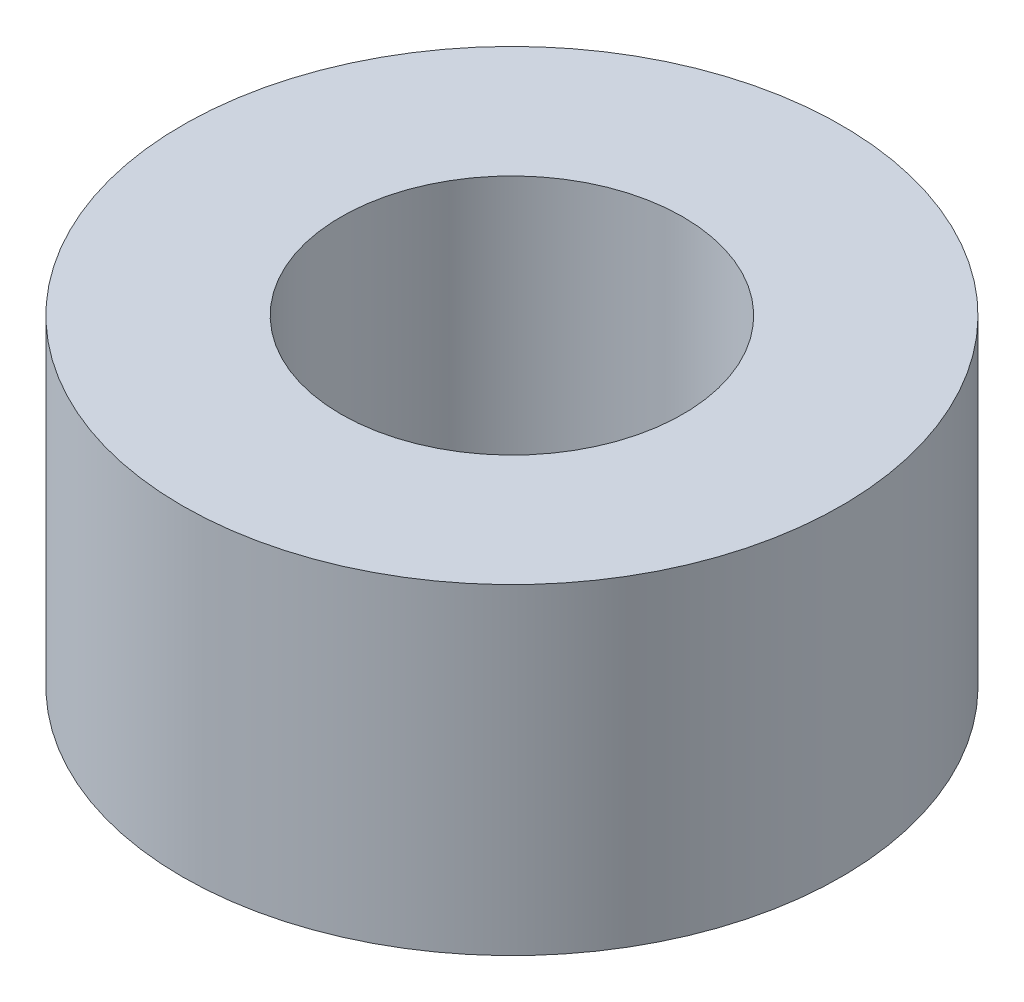
from build123d import *

# Parameters (mm, degrees)
SKIZZE2_R                       = 4
AUFSATZ_LINEAR_AUSTRAGEN1_DEPTH = 3.9
SKIZZE3_R                       = 2.075
SCHNITT_LINEAR_AUSTRAGEN1_DEPTH = 3.9


with BuildPart() as part:
    # Skizze2 → Aufsatz-Linear austragen1 (new body)
    with BuildSketch(Plane(origin=(0, 0, 0), x_dir=(1, 0, 0), z_dir=(0, 1, 0))):
        with Locations(Location((0, 0, 0), (0, 0, 270))):
            Circle(SKIZZE2_R)
    extrude(amount=AUFSATZ_LINEAR_AUSTRAGEN1_DEPTH)

    # Skizze3 → Schnitt-Linear austragen1 (cut)
    with BuildSketch(Plane.XZ):
        with Locations(Location((0, 0, 0), (0, 0, 270))):
            Circle(SKIZZE3_R)
    extrude(amount=-SCHNITT_LINEAR_AUSTRAGEN1_DEPTH, mode=Mode.SUBTRACT)


solid = part.part
